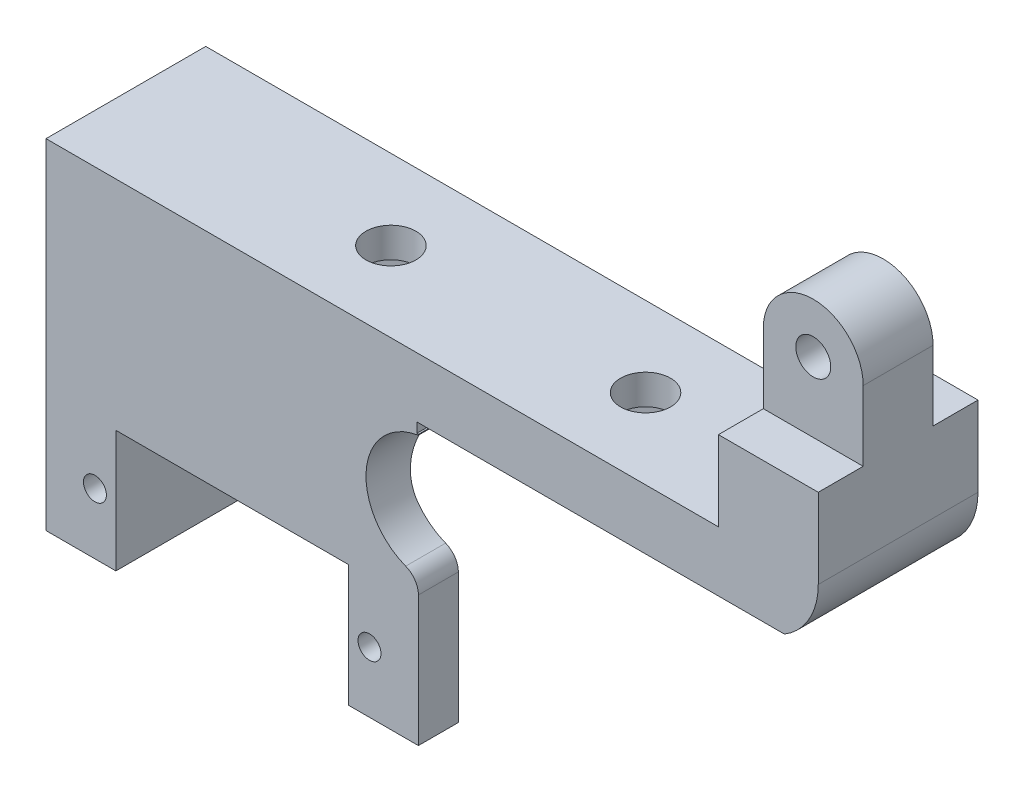
from build123d import *

# Parameters (mm, degrees)
ESQUISSE1_R                = 1.15
BOSS_EXTRU_1_DEPTH         = 16
ESQUISSE5_W                = 10
ESQUISSE5_H                = 4.5
ENL_V_MAT_EXTRU_3_DEPTH    = 12
ESQUISSE6_R                = 1.75
ENL_V_MAT_EXTRU_4_DEPTH    = 86.271756755
ESQUISSE12_W               = 7
ESQUISSE12_H               = 12
ENL_V_MAT_EXTRU_7_DEPTH    = 27
ESQUISSE14_W               = 23.3
ESQUISSE14_H               = 14.8
BOSS_EXTRU_2_DEPTH         = 4
CONG_1_R                   = 10
ESQUISSE15_R               = 6.25
ENL_V_MAT_EXTRU_8_DEPTH    = 18
CONG_2_R                   = 2
CONG_3_R                   = 7
R_P_TITION_LIN_AIRE1_COUNT = 2
R_P_TITION_LIN_AIRE1_PITCH = 25.5
ENL_V_MAT_EXTRU_9_DEPTH    = 40.213671452
ENL_V_START                = -4
ENL_V_MAT_EXTRU_10_DEPTH   = 88.47468181
R_P_TITION_LIN_AIRE2_COUNT = 2
R_P_TITION_LIN_AIRE2_PITCH = 25.5


with BuildPart() as part:
    # Esquisse1 → Boss.-Extru.1 (new body)
    with BuildSketch(Plane.XY):
        Polygon((0, 0), (67.35, 0), (67.35, 20), (77.35, 20), (77.35, -7), (37.3, -7), (37.3, -34), (30.3, -34), (30.3, -7), (7, -7), (7, -34), (0, -34), align=None)
        with Locations((4.9, -27.9)):
            Circle(ESQUISSE1_R, mode=Mode.SUBTRACT)
        with Locations((32.4, -27.9)):
            Circle(ESQUISSE1_R, mode=Mode.SUBTRACT)
    extrude(amount=BOSS_EXTRU_1_DEPTH)

    # Esquisse5 → Enlèv. mat.-Extru.3 (cut)
    with BuildSketch(Plane(origin=(0, 20, 0), x_dir=(1, 0, 0), z_dir=(0, 1, 0))):
        with Locations((72.35, -2.25)):
            Rectangle(ESQUISSE5_W, ESQUISSE5_H)
        with Locations((72.35, -13.75)):
            Rectangle(ESQUISSE5_W, ESQUISSE5_H)
    extrude(amount=-ENL_V_MAT_EXTRU_3_DEPTH, mode=Mode.SUBTRACT)

    # Esquisse6 → Enlèv. mat.-Extru.4 (cut, through all)
    with BuildSketch(Plane.XY.offset(11.5)):
        with Locations((72.35, 15)):
            Circle(ESQUISSE6_R)
        with BuildLine():
            Line((67.35, 15), (65.349467458, 15))
            Line((65.349467458, 15), (65.349467458, 22.000532542))
            Line((65.349467458, 22.000532542), (79.350532542, 22.000532542))
            Line((79.350532542, 22.000532542), (79.350532542, 15))
            Line((79.350532542, 15), (77.35, 15))
            ThreePointArc((77.35, 15), (72.35, 20), (67.35, 15))
        make_face()
    extrude(amount=-ENL_V_MAT_EXTRU_4_DEPTH, mode=Mode.SUBTRACT)

    # Esquisse12 → Enlèv. mat.-Extru.7 (cut)
    with BuildSketch(Plane(origin=(0, -34, 0), x_dir=(-1, 0, 0), z_dir=(0, -1, 0))):
        with Locations((-33.8, -6)):
            Rectangle(ESQUISSE12_W, ESQUISSE12_H)
    extrude(amount=-ENL_V_MAT_EXTRU_7_DEPTH, mode=Mode.SUBTRACT)

    # Esquisse14 → Boss.-Extru.2 (add)
    with BuildSketch(Plane.XY.offset(16)):
        with Locations((18.65, -14.4)):
            Rectangle(ESQUISSE14_W, ESQUISSE14_H)
    extrude(amount=-BOSS_EXTRU_2_DEPTH)

    # Congé1
    cong_1_edges = [part.edges().sort_by_distance(p)[0] for p in [
        (22.15, -7, 12),
        (7, -7, 6),
    ]]
    fillet(cong_1_edges, radius=CONG_1_R)

    # Esquisse15 → Enlèv. mat.-Extru.8 (cut)
    with BuildSketch(Plane.XY.offset(16)):
        with Locations((38.3, -13.25)):
            Circle(ESQUISSE15_R)
    extrude(amount=-ENL_V_MAT_EXTRU_8_DEPTH, mode=Mode.SUBTRACT)

    # Congé2
    cong_2_edges = [part.edges().sort_by_distance(p)[0] for p in [
        (37.3, -19.41948134, 14),
    ]]
    fillet(cong_2_edges, radius=CONG_2_R)

    # Congé3
    cong_3_edges = [part.edges().sort_by_distance(p)[0] for p in [
        (77.35, -7, 8),
    ]]
    fillet(cong_3_edges, radius=CONG_3_R)

    # Esquisse16 → Enlèvement de matière-Révolution1 (revolve, cut)
    with BuildSketch(Plane(origin=(0, 0, 8), x_dir=(-1, 0, 0), z_dir=(0, 0, -1)), mode=Mode.PRIVATE) as enl_vement_de_mati_re_r_volution1_sk:
        Polygon((-52.05, 0), (-52.05, -7), (-52.05, -57), (-48.05, -57), (-48.05, -7), (-49.55, -5.5), (-49.55, 0), align=None)
    enl_vement_de_mati_re_r_volution1 = revolve(enl_vement_de_mati_re_r_volution1_sk.sketch.rotate(Axis((52.05, 0, 8), (0, -1, 0)), 270), axis=Axis((52.05, 0, 8), (0, -1, 0)), mode=Mode.SUBTRACT)

    # Répétition linéaire1: Enlèvement de matière-Révolution1 ×2
    with Locations(*[(-i * R_P_TITION_LIN_AIRE1_PITCH, 0, 0) for i in range(1, R_P_TITION_LIN_AIRE1_COUNT)]):
        add(enl_vement_de_mati_re_r_volution1, mode=Mode.SUBTRACT)

    # Esquisse17 → Enlèv. mat.-Extru.9 (cut)
    with BuildSketch(Plane(origin=(77.35, 0, 0), x_dir=(0, 0, -1), z_dir=(1, 0, 0))):
        Polygon((-9, -7), (-16, -6), (-16, -7), align=None)
    extrude(amount=-ENL_V_MAT_EXTRU_9_DEPTH, mode=Mode.SUBTRACT)

    # Esquisse18 → Enlèv. mat.-Extru.10 (cut)
    with BuildSketch(Plane.XZ.offset(7).offset(ENL_V_START)):
        Polygon((56.2, 10.396003617), (56.2, 5.603996383), (52.05, 3.207992766), (47.9, 5.603996383), (47.9, 10.396003617), (52.05, 12.792007234), align=None)
    enl_v_mat_extru_10 = extrude(amount=ENL_V_MAT_EXTRU_10_DEPTH, mode=Mode.SUBTRACT)

    # Répétition linéaire2: Enlèv. mat.-Extru.10 ×2
    with Locations(*[(-i * R_P_TITION_LIN_AIRE2_PITCH, 0, 0) for i in range(1, R_P_TITION_LIN_AIRE2_COUNT)]):
        add(enl_v_mat_extru_10, mode=Mode.SUBTRACT)


solid = part.part
